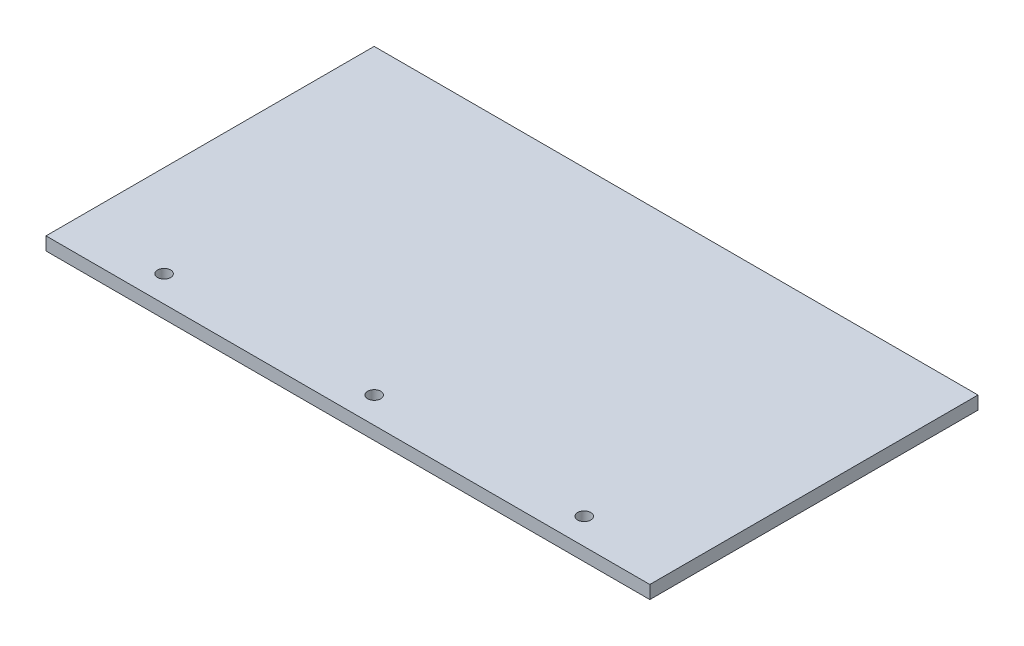
from build123d import *

# Parameters (mm, degrees)
SKETCH1_W           = 292.1
SKETCH1_H           = 158.75
BOSS_EXTRUDE1_DEPTH = 6.35
SKETCH2_R           = 3.175
CUT_EXTRUDE2_DEPTH  = 6.35


with BuildPart() as part:
    # Sketch1 → Boss-Extrude1 (new body)
    with BuildSketch(Plane(origin=(0, 0, 0), x_dir=(1, 0, 0), z_dir=(0, 1, 0))):
        with Locations((146.05, 79.375)):
            Rectangle(SKETCH1_W, SKETCH1_H)
    extrude(amount=BOSS_EXTRUDE1_DEPTH)

    # Sketch2 → Cut-Extrude2 (cut)
    with BuildSketch(Plane(origin=(0, 6.35, 0), x_dir=(1, 0, 0), z_dir=(0, 1, 0))):
        with Locations(Location((146.05, 12.7, 0), (0, 0, 270))):
            Circle(SKETCH2_R)
        with Locations(Location((247.65, 12.7, 0), (0, 0, 270))):
            Circle(SKETCH2_R)
        with Locations(Location((44.45, 12.7, 0), (0, 0, 270))):
            Circle(SKETCH2_R)
    extrude(amount=-CUT_EXTRUDE2_DEPTH, mode=Mode.SUBTRACT)


solid = part.part
